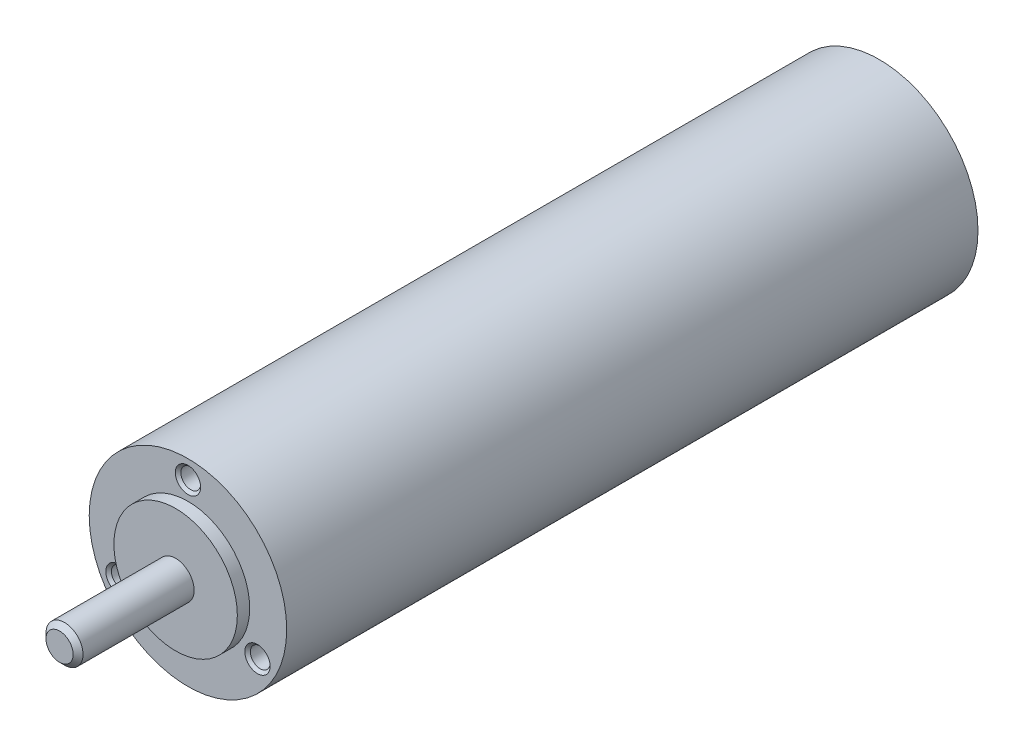
from build123d import *

# Parameters (mm, degrees)
CHAMFER_1_SIZE           = 0.4
PATTERN_CIRCULAR_1_COUNT = 3


with BuildPart() as part:
    # Эскиз1 → Повернуть1 (revolve)
    with BuildSketch(Plane(origin=(0, 0, 0), x_dir=(0, 0, -1), z_dir=(1, 0, 0)), mode=Mode.PRIVATE) as revolve_1_sk:
        Polygon((0, 0), (0, -1.5), (9.4, -1.5), (9.4, -5), (10.4, -5), (10.4, -8), (66.4, -8), (66.4, 0), align=None)
    revolve(revolve_1_sk.sketch.rotate(Axis((0, 0, 0), (0, 0, -1)), 270), axis=Axis((0, 0, 0), (0, 0, -1)))

    # Фаска1
    chamfer_1_edges = [part.edges().sort_by_distance(p)[0] for p in [
        (-1.5, 0, 0),
    ]]
    chamfer(chamfer_1_edges, length=CHAMFER_1_SIZE)

    # Эскиз5 → Отверстие обработанное метчиком M2x0.41 (revolve, cut)
    with BuildSketch(Plane(origin=(0, 6.5, -10.4), x_dir=(0, -1, 0), z_dir=(1, 0, 0))):
        Polygon((0, 0), (0, 4.480688495), (0.8, 4), (0.8, 0.225), (1.025, 0), align=None)
    m2x0_41 = revolve(axis=Axis((0, 6.5, -4.05), (0, 0, -1)), mode=Mode.SUBTRACT)

    # Круговой массив1: Отверстие обработанное метчиком M2x0.41 ×3 about axis
    pattern_circular_1_axis = Axis((0, 0, 0), (0, 0, 1))
    for i in range(1, PATTERN_CIRCULAR_1_COUNT):
        add(m2x0_41.rotate(pattern_circular_1_axis, i * 360 / PATTERN_CIRCULAR_1_COUNT), mode=Mode.SUBTRACT)


solid = part.part
